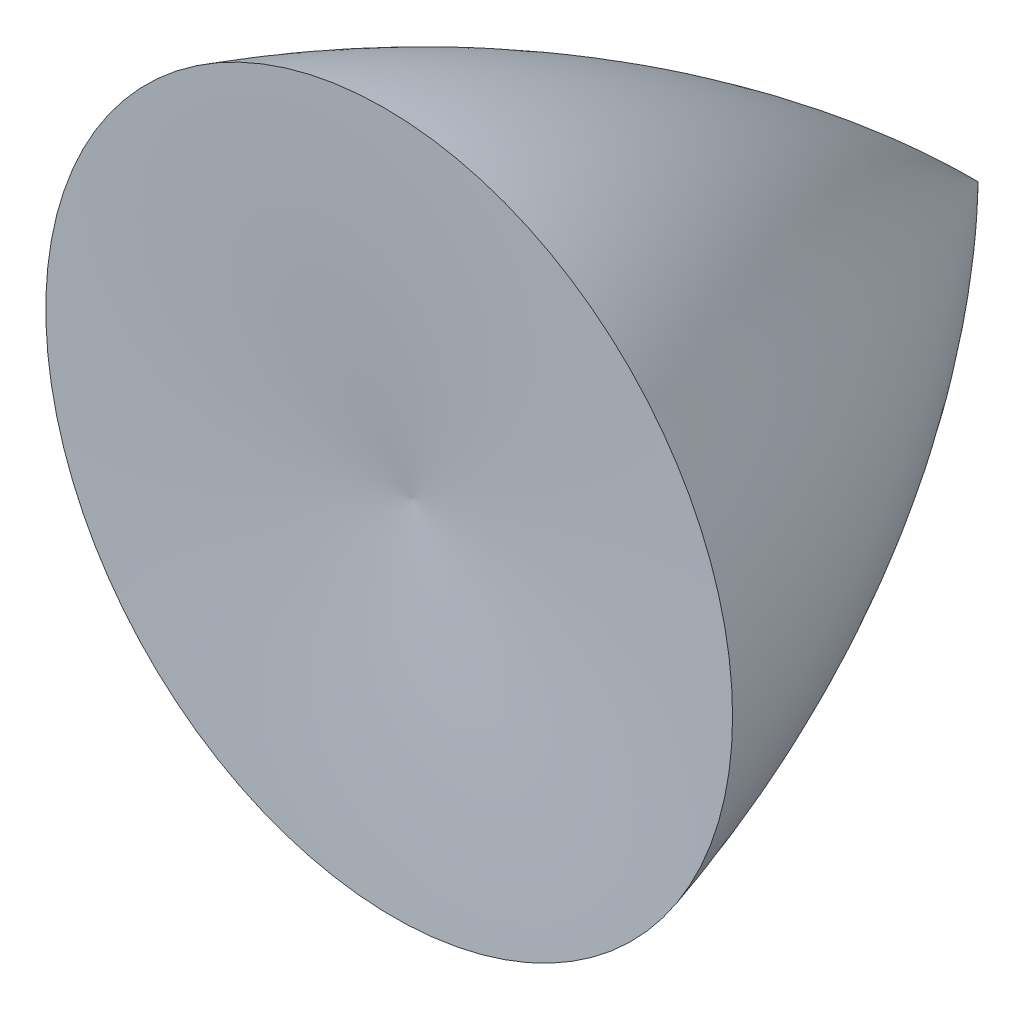
from build123d import *


with BuildPart() as part:
    # Sketch1 → Revolve1 (revolve)
    with BuildSketch(Plane(origin=(0, 0, 0), x_dir=(1, 0, 0), z_dir=(0, 1, 0))):
        with BuildLine():
            Line((1.351261088, 100.488736032), (0, 0))
            ThreePointArc((0, 0), (-31.341032608, -2.230964736), (-62.743023765, -3.304500952))
            ThreePointArc((-62.743023765, -3.304500952), (-37.249394817, 52.639035932), (1.351261088, 100.488736032))
        make_face()
    revolve(axis=Axis((0, 0, 0), (0.013445675517440775, 0, -0.9999096028191147)))


solid = part.part
